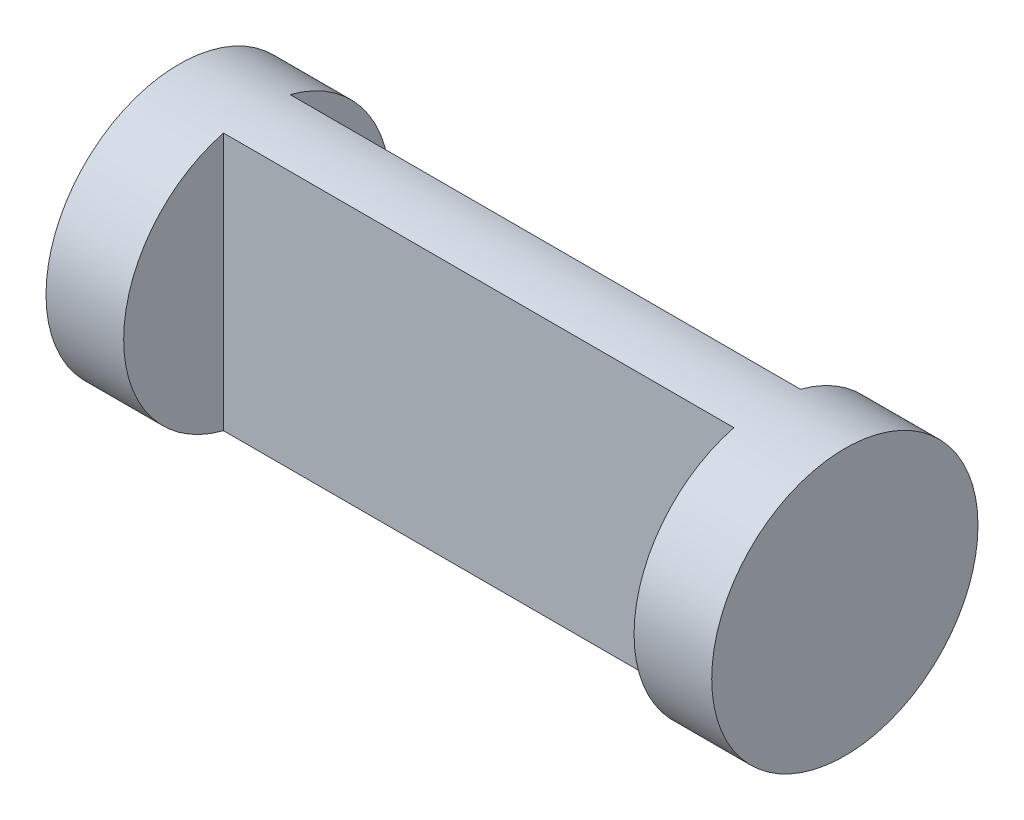
from build123d import *

# Parameters (mm, degrees)
SKETCH_1_W          = 60
SKETCH_1_H          = 12
CUT_EXTRUDE_2_DEPTH = 23


with BuildPart() as part:
    # Эскиз1 → Повернуть1 (revolve)
    with BuildSketch(Plane.XY, mode=Mode.PRIVATE) as revolve_1_sk:
        with Locations((30, 6)):
            Rectangle(SKETCH_1_W, SKETCH_1_H)
    revolve(revolve_1_sk.sketch.rotate(Axis((0, 0, 0), (1, 0, 0)), 90), axis=Axis((0, 0, 0), (1, 0, 0)))

    # Эскиз2 → Вырез-Вытянуть2 (cut, symmetric)
    with BuildSketch(Plane.ZY.offset(-30)):
        Polygon((3, 77.578035125), (3, 11.618950039), (3, -11.618950039), (3, -77.578035125), (134.918170173, -77.578035125), (134.918170173, 77.578035125), align=None)
    cut_extrude_2 = extrude(amount=CUT_EXTRUDE_2_DEPTH, both=True, mode=Mode.SUBTRACT)

    # Зеркальное отражение1: Вырез-Вытянуть2 across plane
    add(cut_extrude_2.mirror(Plane.XY), mode=Mode.SUBTRACT)


solid = part.part
